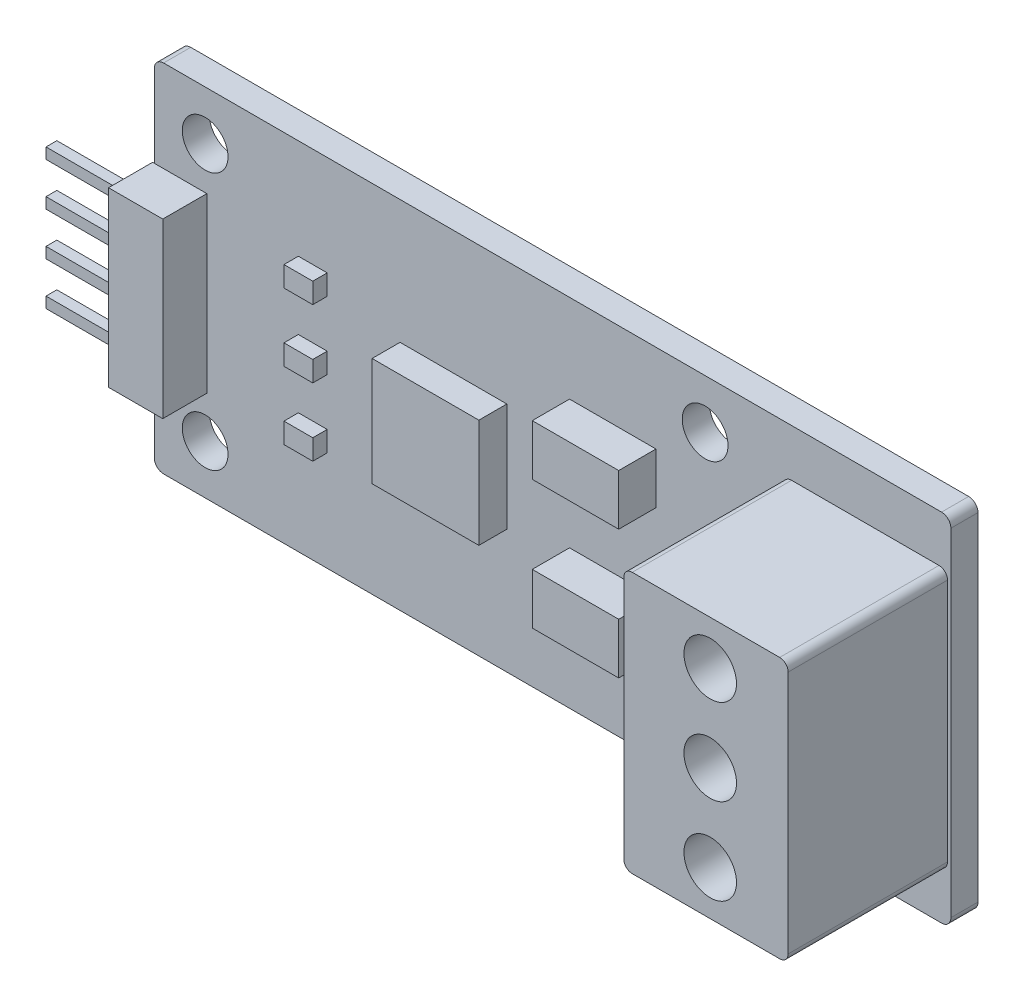
from build123d import *

# Parameters (mm, degrees)
PCB_OVERVOLTAGE_PROTECTION_SKETCH_R = 1.35
PCB_OVERVOLTAGE_PROTECTION_DEPTH    = 1.6
TTL_2P54_HEADER_START               = 1.6
TTL_2P54_HEADER_SKETCH_W            = 3.2
TTL_2P54_HEADER_SKETCH_H            = 10.2
TTL_2P54_HEADER_DEPTH               = 2.6
FOUR_TTL_PINS_2P54_START            = 2.35
FOUR_TTL_PINS_2P54_SKETCH_W         = 4.9
FOUR_TTL_PINS_2P54_SKETCH_H         = 0.64
FOUR_TTL_PINS_2P54_DEPTH            = 0.64
FOUR_TTL_PINS_2P54_2_DEPTH          = 0.64
FOUR_TTL_PINS_2P54_3_DEPTH          = 0.64
FOUR_TTL_PINS_2P54_4_DEPTH          = 0.64
THREE_POSITION_RS485_TERMINAL_START = 1.6
THREE_POSITION_RS485_TERMINAL_DEPTH = 9.4
TERMINAL_SCREW_ACCESS_START         = 8
TERMINAL_SCREW_ACCESS_SKETCH_R      = 1.55
TERMINAL_SCREW_ACCESS_DEPTH         = 3
TRANSCEIVER_START                   = 1.6
TRANSCEIVER_SKETCH_W                = 6.3
TRANSCEIVER_SKETCH_H                = 6.4
TRANSCEIVER_DEPTH                   = 1.65
TVS_A_START                         = 1.6
TVS_A_SKETCH_W                      = 5.1
TVS_A_SKETCH_H                      = 3
TVS_A_DEPTH                         = 2.2
TVS_B_START                         = 1.6
TVS_B_SKETCH_W                      = 5.1
TVS_B_SKETCH_H                      = 3
TVS_B_DEPTH                         = 2.2
STATUS_LEDS_START                   = 1.6
STATUS_LEDS_SKETCH_W                = 1.7
STATUS_LEDS_SKETCH_H                = 1.2
STATUS_LEDS_DEPTH                   = 0.85
STATUS_LEDS_2_DEPTH                 = 0.85
STATUS_LEDS_3_DEPTH                 = 0.85


with BuildPart() as part:
    # PCB_Overvoltage_protection_Sketch → PCB_Overvoltage_protection (new body)
    with BuildSketch(Plane.XY):
        with BuildLine():
            Line((-22.95, -10.5), (22.95, -10.5))
            ThreePointArc((22.95, -10.5), (23.33890873, -10.33890873), (23.5, -9.95))
            Line((23.5, -9.95), (23.5, 9.95))
            ThreePointArc((23.5, 9.95), (23.33890873, 10.33890873), (22.95, 10.5))
            Line((22.95, 10.5), (-22.95, 10.5))
            ThreePointArc((-22.95, 10.5), (-23.33890873, 10.33890873), (-23.5, 9.95))
            Line((-23.5, 9.95), (-23.5, -9.95))
            ThreePointArc((-23.5, -9.95), (-23.33890873, -10.33890873), (-22.95, -10.5))
        make_face()
        with Locations((-20.5, -7.6)):
            Circle(PCB_OVERVOLTAGE_PROTECTION_SKETCH_R, mode=Mode.SUBTRACT)
        with Locations((-20.5, 7.6)):
            Circle(PCB_OVERVOLTAGE_PROTECTION_SKETCH_R, mode=Mode.SUBTRACT)
        with Locations((9, -7.6)):
            Circle(PCB_OVERVOLTAGE_PROTECTION_SKETCH_R, mode=Mode.SUBTRACT)
        with Locations((9, 7.6)):
            Circle(PCB_OVERVOLTAGE_PROTECTION_SKETCH_R, mode=Mode.SUBTRACT)
    extrude(amount=PCB_OVERVOLTAGE_PROTECTION_DEPTH)


with BuildPart() as body_2:
    # TTL_2p54_Header_Sketch → TTL_2p54_Header (new body)
    with BuildSketch(Plane.XY.offset(TTL_2P54_HEADER_START)):
        with Locations((-22, 0)):
            Rectangle(TTL_2P54_HEADER_SKETCH_W, TTL_2P54_HEADER_SKETCH_H)
    extrude(amount=TTL_2P54_HEADER_DEPTH)


with BuildPart() as body_3:
    # Four_TTL_Pins_2p54_Sketch → Four_TTL_Pins_2p54 (new body)
    with BuildSketch(Plane.XY.offset(FOUR_TTL_PINS_2P54_START)):
        with Locations((-26.05, -3.81)):
            Rectangle(FOUR_TTL_PINS_2P54_SKETCH_W, FOUR_TTL_PINS_2P54_SKETCH_H)
    extrude(amount=FOUR_TTL_PINS_2P54_DEPTH)


with BuildPart() as body_4:
    # Four_TTL_Pins_2p54_Sketch → Four_TTL_Pins_2p54 2 (new body)
    with BuildSketch(Plane.XY.offset(FOUR_TTL_PINS_2P54_START)):
        with Locations((-26.05, -1.27)):
            Rectangle(FOUR_TTL_PINS_2P54_SKETCH_W, FOUR_TTL_PINS_2P54_SKETCH_H)
    extrude(amount=FOUR_TTL_PINS_2P54_2_DEPTH)


with BuildPart() as body_5:
    # Four_TTL_Pins_2p54_Sketch → Four_TTL_Pins_2p54 3 (new body)
    with BuildSketch(Plane.XY.offset(FOUR_TTL_PINS_2P54_START)):
        with Locations((-26.05, 1.27)):
            Rectangle(FOUR_TTL_PINS_2P54_SKETCH_W, FOUR_TTL_PINS_2P54_SKETCH_H)
    extrude(amount=FOUR_TTL_PINS_2P54_3_DEPTH)


with BuildPart() as body_6:
    # Four_TTL_Pins_2p54_Sketch → Four_TTL_Pins_2p54 4 (new body)
    with BuildSketch(Plane.XY.offset(FOUR_TTL_PINS_2P54_START)):
        with Locations((-26.05, 3.81)):
            Rectangle(FOUR_TTL_PINS_2P54_SKETCH_W, FOUR_TTL_PINS_2P54_SKETCH_H)
    extrude(amount=FOUR_TTL_PINS_2P54_4_DEPTH)


with BuildPart() as body_7:
    # Three_position_RS485_terminal_Sketch → Three_position_RS485_terminal (new body)
    with BuildSketch(Plane.XY.offset(THREE_POSITION_RS485_TERMINAL_START)):
        with BuildLine():
            Line((14.1, -7.7), (22.8, -7.7))
            ThreePointArc((22.8, -7.7), (23.153553391, -7.553553391), (23.3, -7.2))
            Line((23.3, -7.2), (23.3, 7.2))
            ThreePointArc((23.3, 7.2), (23.153553391, 7.553553391), (22.8, 7.7))
            Line((22.8, 7.7), (14.1, 7.7))
            ThreePointArc((14.1, 7.7), (13.746446609, 7.553553391), (13.6, 7.2))
            Line((13.6, 7.2), (13.6, -7.2))
            ThreePointArc((13.6, -7.2), (13.746446609, -7.553553391), (14.1, -7.7))
        make_face()
    extrude(amount=THREE_POSITION_RS485_TERMINAL_DEPTH)

    # Terminal_screw_access_Sketch → Terminal_screw_access (cut)
    with BuildSketch(Plane.XY.offset(TERMINAL_SCREW_ACCESS_START)):
        with Locations((18.7, -5.08)):
            Circle(TERMINAL_SCREW_ACCESS_SKETCH_R)
        with Locations((18.7, 0)):
            Circle(TERMINAL_SCREW_ACCESS_SKETCH_R)
        with Locations((18.7, 5.08)):
            Circle(TERMINAL_SCREW_ACCESS_SKETCH_R)
    extrude(amount=TERMINAL_SCREW_ACCESS_DEPTH, mode=Mode.SUBTRACT)


with BuildPart() as body_8:
    # Transceiver_Sketch → Transceiver (new body)
    with BuildSketch(Plane.XY.offset(TRANSCEIVER_START)):
        with Locations((-5.85, 0)):
            Rectangle(TRANSCEIVER_SKETCH_W, TRANSCEIVER_SKETCH_H)
    extrude(amount=TRANSCEIVER_DEPTH)


with BuildPart() as body_9:
    # TVS_A_Sketch → TVS_A (new body)
    with BuildSketch(Plane.XY.offset(TVS_A_START)):
        with Locations((3.55, -3.8)):
            Rectangle(TVS_A_SKETCH_W, TVS_A_SKETCH_H)
    extrude(amount=TVS_A_DEPTH)


with BuildPart() as body_10:
    # TVS_B_Sketch → TVS_B (new body)
    with BuildSketch(Plane.XY.offset(TVS_B_START)):
        with Locations((3.55, 3.8)):
            Rectangle(TVS_B_SKETCH_W, TVS_B_SKETCH_H)
    extrude(amount=TVS_B_DEPTH)


with BuildPart() as body_11:
    # Status_LEDs_Sketch → Status_LEDs (new body)
    with BuildSketch(Plane.XY.offset(STATUS_LEDS_START)):
        with Locations((-14.15, -4)):
            Rectangle(STATUS_LEDS_SKETCH_W, STATUS_LEDS_SKETCH_H)
    extrude(amount=STATUS_LEDS_DEPTH)


with BuildPart() as body_12:
    # Status_LEDs_Sketch → Status_LEDs 2 (new body)
    with BuildSketch(Plane.XY.offset(STATUS_LEDS_START)):
        with Locations((-14.15, 0)):
            Rectangle(STATUS_LEDS_SKETCH_W, STATUS_LEDS_SKETCH_H)
    extrude(amount=STATUS_LEDS_2_DEPTH)


with BuildPart() as body_13:
    # Status_LEDs_Sketch → Status_LEDs 3 (new body)
    with BuildSketch(Plane.XY.offset(STATUS_LEDS_START)):
        with Locations((-14.15, 4)):
            Rectangle(STATUS_LEDS_SKETCH_W, STATUS_LEDS_SKETCH_H)
    extrude(amount=STATUS_LEDS_3_DEPTH)


solid = Compound([part.part, body_2.part, body_3.part, body_4.part, body_5.part, body_6.part, body_7.part, body_8.part, body_9.part, body_10.part, body_11.part, body_12.part, body_13.part])
